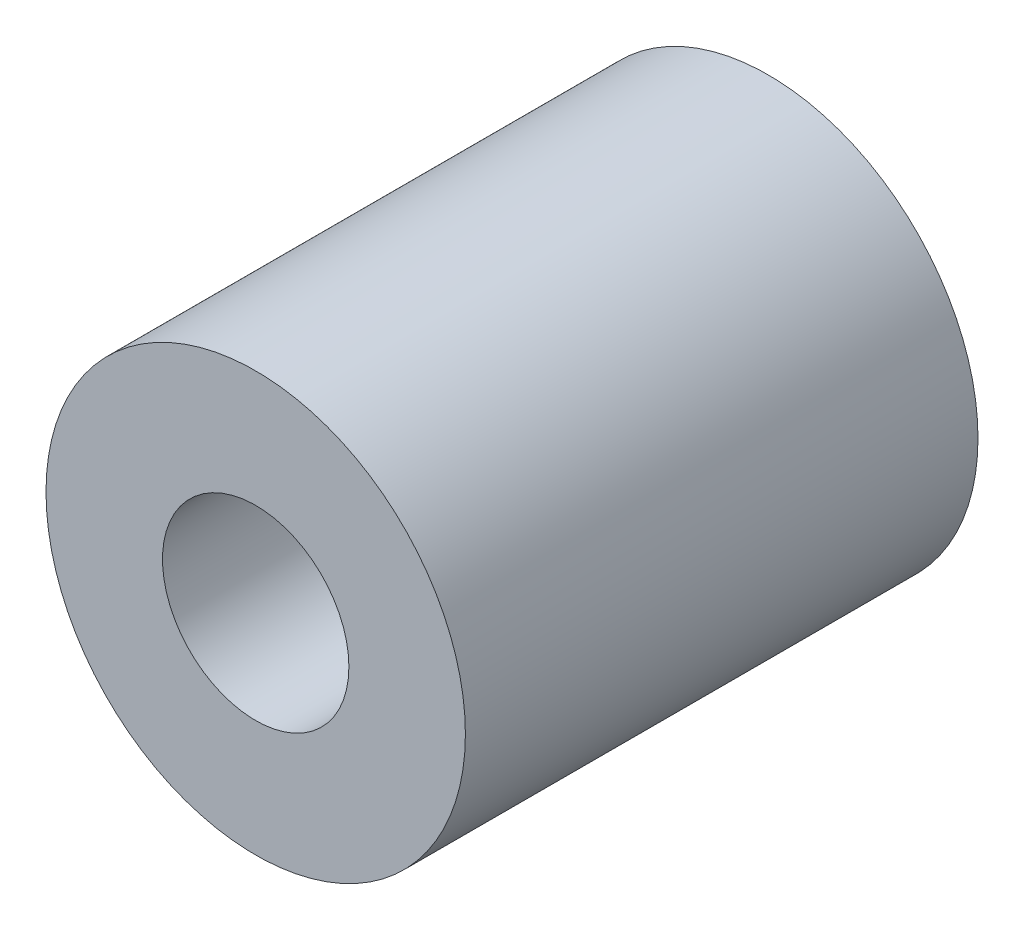
from build123d import *

# Parameters (mm, degrees)
SKETCH_8_R      = 45
SKETCH_8_R_2    = 20
EXTRUDE_1_DEPTH = 110


with BuildPart() as part:
    # 草图8 → 凸台-拉伸1 (new body)
    with BuildSketch(Plane.XY):
        Circle(SKETCH_8_R)
        Circle(SKETCH_8_R_2, mode=Mode.SUBTRACT)
    extrude(amount=EXTRUDE_1_DEPTH)


solid = part.part
